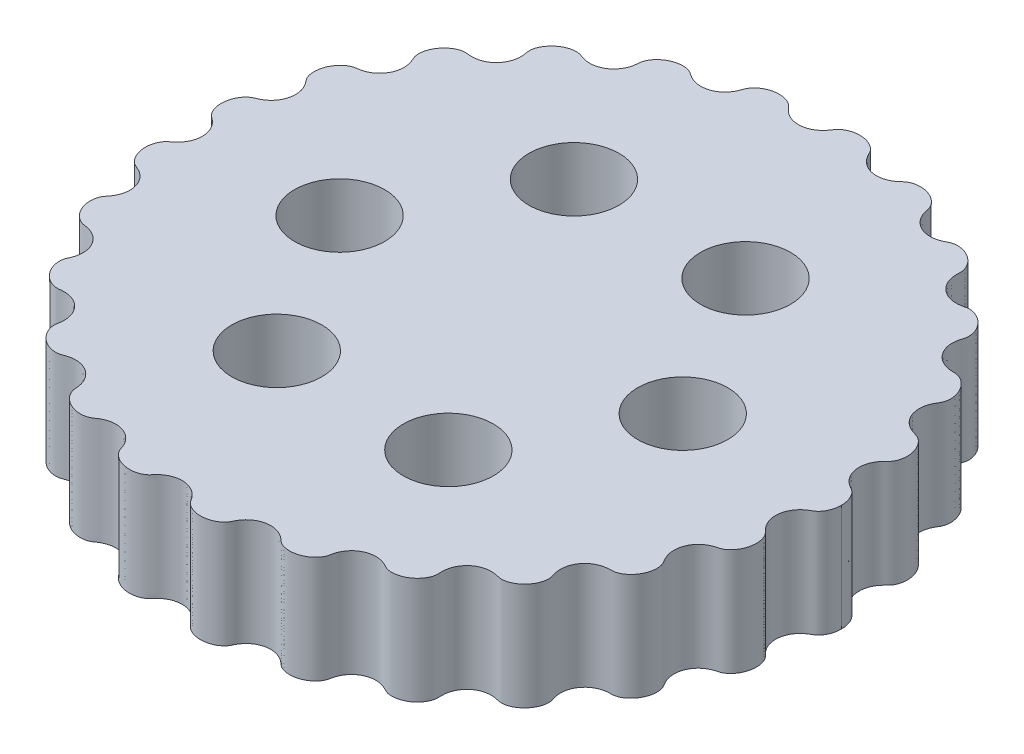
from build123d import *

# Parameters (mm, degrees)
BOSS_EXTRUDE1_DEPTH = 5
SKETCH4_R           = 2.1
CUT_EXTRUDE1_DEPTH  = 23.948222139


with BuildPart() as part:
    # Sketch3 → Boss-Extrude1 (new body)
    with BuildSketch(Plane(origin=(0, 0, 0), x_dir=(1, 0, 0), z_dir=(0, 1, 0))):
        with BuildLine():
            add(Edge.make_bspline(
                [(-15.4, -1.7e-08), (-15.4, -0.0179639), (-15.400999323, -0.054155777), (-15.405496281, -0.123245559), (-15.417452591, -0.205733747), (-15.435300776, -0.284760884), (-15.458936185, -0.36382984), (-15.4955307, -0.460103318), (-15.553831728, -0.577672704), (-15.628963253, -0.690475222), (-15.720523696, -0.795156244), (-15.809877897, -0.878529714), (-15.885972355, -0.939710329), (-15.965266265, -0.996877228), (-16.039390288, -1.060755735), (-16.10181304, -1.136526935), (-16.154322588, -1.219306622), (-16.208602379, -1.329232849), (-16.256294452, -1.46879725), (-16.288096989, -1.638083761), (-16.294503336, -1.881017955), (-16.252297954, -2.119867972), (-16.163760076, -2.344380216), (-16.042398431, -2.523140087), (-15.942454271, -2.628650585), (-15.845311894, -2.703603777), (-15.757199339, -2.750371169), (-15.664408514, -2.786732354), (-15.573413087, -2.826965839), (-15.463621848, -2.885730199), (-15.308968468, -2.990239539), (-15.130503779, -3.165844736), (-14.972147574, -3.434992914), (-14.893985659, -3.773341986), (-14.916927638, -4.080338877), (-14.99517113, -4.310200414), (-15.082412287, -4.468541985), (-15.150259423, -4.567703676), (-15.210025776, -4.642870286), (-15.270573612, -4.717649143), (-15.32017627, -4.800200549), (-15.365416739, -4.910918984), (-15.399338412, -5.049561592), (-15.416852165, -5.262398458), (-15.384340028, -5.5009375), (-15.304055963, -5.731023402), (-15.177986067, -5.941781697), (-15.047854273, -6.095731633), (-14.910789064, -6.208565627), (-14.777136668, -6.28441619), (-14.654566295, -6.325933715), (-14.550559851, -6.34133531), (-14.446683567, -6.35561525), (-14.344145812, -6.378219285), (-14.218558725, -6.416412597), (-14.049117893, -6.490187762), (-13.850381141, -6.623876916), (-13.649361581, -6.848376603), (-13.506075289, -7.152261929), (-13.462998345, -7.45100292), (-13.489971843, -7.692058337), (-13.539204567, -7.862350469), (-13.58028655, -7.968000385), (-13.618269724, -8.050352742), (-13.654435369, -8.133644503), (-13.678283679, -8.221362416), (-13.692937864, -8.335980969), (-13.690655579, -8.476153238), (-13.654303066, -8.685493325), (-13.545223721, -8.951238924), (-13.373056915, -9.18372267), (-13.149188347, -9.366304533), (-12.953264028, -9.463318121), (-12.811586105, -9.506241228), (-12.68673142, -9.522483755), (-12.583488535, -9.516968649), (-12.481158125, -9.503432716), (-12.378198476, -9.49685897), (-12.27492903, -9.498212364), (-12.172138273, -9.508022388), (-12.00848977, -9.538189582), (-11.791017895, -9.615836238), (-11.543764772, -9.778692112), (-11.347433699, -10.024278174), (-11.24020905, -10.268607243), (-11.19432556, -10.4842435), (-11.185347516, -10.63842955), (-11.193136478, -10.770510134), (-11.209146043, -10.879533357), (-11.225593066, -10.966240155), (-11.235972293, -11.053921722), (-11.233096174, -11.14231144), (-11.215768637, -11.253426089), (-11.176715648, -11.384209608), (-11.088557124, -11.571772914), (-10.914554892, -11.800570582), (-10.643928842, -12.015790255), (-10.338393618, -12.131431431), (-10.092328192, -12.151919487), (-9.938831235, -12.124722276), (-9.874147715, -12.104917478), (-9.823296604, -12.086266589), (-9.760021595, -12.062210307), (-9.657742326, -12.026792469), (-9.512708412, -11.991319544), (-9.295428082, -11.971044547), (-9.02334194, -12.005783395), (-8.739745297, -12.120021194), (-8.477485926, -12.330308501), (-8.309271036, -12.575785962), (-8.227745391, -12.796401702), (-8.194847398, -12.964652111), (-8.183073102, -13.072922796), (-8.177409858, -13.159952001), (-8.163855825, -13.268191546), (-8.120743914, -13.396146369), (-8.043211398, -13.535732082), (-7.896275201, -13.715388562), (-7.667817547, -13.89629622), (-7.347778673, -14.038713114), (-7.019984797, -14.07273381), (-6.761854834, -14.026889823), (-6.59853775, -13.94382338), (-6.512636175, -13.880075123), (-6.401772895, -13.805681084), (-6.259871426, -13.730304261), (-6.052431116, -13.656485392), (-5.773826739, -13.622953293), (-5.462558712, -13.668320375), (-5.188838654, -13.799904226), (-4.991154659, -13.966548005), (-4.857833569, -14.133925624), (-4.782594941, -14.263163017), (-4.730894943, -14.37994671), (-4.695923054, -14.480037727), (-4.66890297, -14.56056082), (-4.625076131, -14.657310654), (-4.54939566, -14.764706998), (-4.439982259, -14.875186463), (-4.255657312, -15.006022923), (-3.992826377, -15.120143933), (-3.651468639, -15.175703502), (-3.340640217, -15.129056134), (-3.125824401, -15.033765101), (-3.010951868, -14.946774658), (-2.969759145, -14.909017318), (-2.931738803, -14.868052577), (-2.895415689, -14.825543041), (-2.84986284, -14.772584095), (-2.7734756, -14.691023901), (-2.657607025, -14.589329641), (-2.467715995, -14.468702204), (-2.201270046, -14.374829479), (-1.894275868, -14.351781179), (-1.570472458, -14.423576615), (-1.317305203, -14.563244078), (-1.151543923, -14.714094048), (-1.04813492, -14.841768331), (-0.988592189, -14.928872781), (-0.943008575, -15.000049311), (-0.879486199, -15.084516921), (-0.783319073, -15.171117196), (-0.654507937, -15.252082104), (-0.451621783, -15.335584214), (-0.187231226, -15.385412397), (0.083980968, -15.372590964), (0.344980032, -15.297228196), (0.543453885, -15.192187935), (0.665765143, -15.097631221), (0.754670734, -15.002004552), (0.81122491, -14.912765397), (0.848285287, -14.836852758), (0.894840455, -14.74223026), (0.98113323, -14.596440599), (1.130461793, -14.415291718), (1.371747889, -14.237402863), (1.694146895, -14.124303695), (2.005808041, -14.112082231), (2.279803051, -14.174237519), (2.481366281, -14.271328262), (2.607738457, -14.358112186), (2.692850973, -14.429557513), (2.744274132, -14.47627699), (2.785484759, -14.513602657), (2.83903745, -14.557815956), (2.971848236, -14.642560885), (3.209212351, -14.716336014), (3.537870388, -14.723205652), (3.870973419, -14.623309487), (4.11916488, -14.474113286), (4.287203057, -14.316127467), (4.381819528, -14.188748976), (4.44158696, -14.068624449), (4.46975473, -13.963936363), (4.486205481, -13.878818184), (4.510615899, -13.773375752), (4.562786182, -13.611201438), (4.66864039, -13.402850265), (4.861501994, -13.180790163), (5.140858177, -13.003604886), (5.432389304, -12.920478681), (5.707047345, -12.913935038), (5.924587681, -12.957968109), (6.070502921, -13.011926078), (6.171892994, -13.061226431), (6.234172828, -13.094293466), (6.284238608, -13.120335816), (6.348454821, -13.149382165), (6.450393222, -13.181304954), (6.592860438, -13.199324221), (6.822504709, -13.187513089), (7.108179517, -13.101881376), (7.360700325, -12.94808107), (7.564054883, -12.73925691), (7.686860667, -12.541024919), (7.745859355, -12.391333051), (7.771139719, -12.25794445), (7.769723909, -12.148157851), (7.764489141, -12.060599044), (7.763284167, -11.951024257), (7.773134803, -11.821211353), (7.801859755, -11.67318884), (7.872937972, -11.471739613), (8.004528849, -11.24999796), (8.220498534, -11.035105946), (8.499738314, -10.890461176), (8.747534026, -10.836884184), (8.938296489, -10.832212379), (9.067515609, -10.84372343), (9.169837853, -10.860856784), (9.270401729, -10.885914792), (9.371725278, -10.908894608), (9.499541205, -10.914402306), (9.649899789, -10.893031253), (9.864422416, -10.823594645), (10.115447302, -10.670178671), (10.318488659, -10.460804359), (10.461426998, -10.211874516), (10.524753244, -10.013390778), (10.546392194, -9.877676821), (10.548710352, -9.764592984), (10.539340366, -9.676133963), (10.516898829, -9.59020607), (10.489593571, -9.505763599), (10.460576873, -9.398790161), (10.437116372, -9.267754133), (10.428038926, -9.112623212), (10.448899743, -8.891731524), (10.525306813, -8.64437807), (10.680560241, -8.391693434), (10.908335396, -8.189291613), (11.146089939, -8.066430889), (11.351541147, -8.0111775), (11.509041531, -7.991838751), (11.640826936, -7.989459787), (11.746564255, -7.988165472), (11.874375994, -7.963827156), (12.017764748, -7.905879024), (12.169249379, -7.811411044), (12.319018229, -7.674673684), (12.471981877, -7.480513941), (12.581459023, -7.260882683), (12.644013621, -7.026574368), (12.652861266, -6.812938998), (12.636539545, -6.672849387), (12.606445883, -6.5605133), (12.570431517, -6.476445233), (12.523166311, -6.398236767), (12.47516976, -6.320637062), (12.421523381, -6.219947933), (12.352206784, -6.055608729), (12.297223468, -5.817804774), (12.306144256, -5.511230912), (12.418271093, -5.185791565), (12.599550957, -4.937284708), (12.788421932, -4.782569721), (12.950444572, -4.693121703), (13.068010823, -4.6440806), (13.16467846, -4.61208059), (13.263358977, -4.586967488), (13.360622852, -4.556202811), (13.472064743, -4.497212422), (13.590575025, -4.405386881), (13.741515844, -4.240875834), (13.885567919, -3.984039), (13.960547448, -3.70001255), (13.96247714, -3.409355977), (13.917122724, -3.199364102), (13.864866306, -3.065549508), (13.804762582, -2.961266953), (13.743749695, -2.885984813), (13.673498703, -2.819365216), (13.604760055, -2.751453192), (13.541077577, -2.67863428), (13.482882445, -2.60133554), (13.398435152, -2.468447693), (13.309916002, -2.267780725), (13.257239645, -1.991629219), (13.294765521, -1.652710176), (13.415656685, -1.372496179), (13.564768534, -1.180601513), (13.700945726, -1.058516365), (13.801501699, -0.985660094), (13.885953477, -0.933564852), (13.973240527, -0.886145841), (14.05595319, -0.830914413), (14.145346016, -0.74570159), (14.234104588, -0.627875673), (14.302099652, -0.497915946), (14.350570879, -0.359468477), (14.378415715, -0.242179542), (14.393222635, -0.147287137), (14.398767776, -0.06351789), (14.4, -0.021212327), (14.4, -1.7e-08)],
                knots=[0.062565796, 0.062565796, 0.062565796, 0.062565796, 0.062565796, 0.063859973, 0.06515415, 0.066448326, 0.067742503, 0.06903668, 0.070330857, 0.07291921, 0.075992333, 0.077528894, 0.079065456, 0.080602017, 0.082138578, 0.08367514, 0.085211701, 0.086753761, 0.088295822, 0.091379943, 0.094464064, 0.097548185, 0.103528845, 0.106519174, 0.109509504, 0.111075374, 0.112641243, 0.114207112, 0.115772981, 0.117338851, 0.11890472, 0.122036458, 0.127492162, 0.132947866, 0.138255082, 0.143562297, 0.146585003, 0.148096356, 0.149607709, 0.151119061, 0.152630414, 0.154141767, 0.15565312, 0.158617995, 0.161582869, 0.167512619, 0.170668106, 0.173823593, 0.17697908, 0.180134567, 0.181785014, 0.183435461, 0.185085908, 0.186736355, 0.188386802, 0.190037249, 0.193338142, 0.198333612, 0.203329082, 0.208757311, 0.21418554, 0.217038738, 0.218465337, 0.219891935, 0.221318534, 0.222745133, 0.224171732, 0.225598331, 0.22856804, 0.23153775, 0.237477169, 0.243508984, 0.246524892, 0.2495408, 0.251163787, 0.252786774, 0.254409762, 0.256032749, 0.257655736, 0.259278723, 0.26090171, 0.262524697, 0.268116353, 0.273708009, 0.279232337, 0.2819945, 0.284756664, 0.287531357, 0.288918704, 0.290306051, 0.291693397, 0.293080744, 0.294468091, 0.295855437, 0.298751953, 0.301648468, 0.307441499, 0.313806246, 0.320170993, 0.321874543, 0.322726318, 0.323578093, 0.324429868, 0.325281643, 0.326985192, 0.330392292, 0.333799391, 0.338941908, 0.344084424, 0.349371027, 0.354657629, 0.357399899, 0.358771034, 0.360142168, 0.361513303, 0.362884438, 0.365626708, 0.368571539, 0.37151637, 0.377406032, 0.383827609, 0.390249186, 0.391929851, 0.393610516, 0.39529118, 0.396971845, 0.400333174, 0.403694503, 0.409075747, 0.41445699, 0.419832854, 0.422520785, 0.425208717, 0.427878342, 0.429213155, 0.430547968, 0.431882781, 0.433217593, 0.435887219, 0.438758038, 0.441628857, 0.447370496, 0.453780785, 0.460191075, 0.461070296, 0.461949517, 0.462828738, 0.463707959, 0.46458718, 0.465466401, 0.467224842, 0.470741726, 0.47425861, 0.479541903, 0.484825197, 0.489835983, 0.494846769, 0.497503724, 0.498832202, 0.500160679, 0.501489157, 0.502817634, 0.505474589, 0.508247059, 0.511019529, 0.516564468, 0.52227034, 0.525123276, 0.527976212, 0.530631288, 0.531958826, 0.533286364, 0.534613902, 0.53594144, 0.538596516, 0.543936045, 0.549275574, 0.554531257, 0.559786941, 0.563284399, 0.566781857, 0.568530587, 0.569404951, 0.570279316, 0.57115368, 0.572028045, 0.573776774, 0.580152949, 0.586529123, 0.592383377, 0.595310504, 0.598237631, 0.600962992, 0.602325673, 0.603688354, 0.605051034, 0.606413715, 0.609139076, 0.614392618, 0.619646159, 0.624660447, 0.629674735, 0.633223523, 0.636772312, 0.638546707, 0.639433904, 0.640321101, 0.641208298, 0.642095495, 0.64386989, 0.647025799, 0.650181709, 0.656493529, 0.662419511, 0.665382503, 0.668345494, 0.671104535, 0.672484055, 0.673863575, 0.675243096, 0.676622616, 0.679381657, 0.682041398, 0.68470114, 0.690020622, 0.695473381, 0.700926139, 0.704188253, 0.70581931, 0.707450368, 0.709081425, 0.710712482, 0.712343539, 0.713974596, 0.717095441, 0.720216286, 0.726457975, 0.732286917, 0.735201388, 0.738115858, 0.739511278, 0.740906697, 0.742302116, 0.743697535, 0.745092954, 0.746488373, 0.749279211, 0.752059022, 0.754838832, 0.760398454, 0.765423781, 0.770449108, 0.773768675, 0.777088241, 0.778748025, 0.780407808, 0.782067591, 0.783727374, 0.786901153, 0.790074931, 0.793248709, 0.796422487, 0.802397424, 0.805384893, 0.808372361, 0.809807963, 0.811243566, 0.812679168, 0.81411477, 0.815550372, 0.816985974, 0.819857178, 0.825317904, 0.830778629, 0.835989797, 0.841200965, 0.844404173, 0.846005778, 0.847607382, 0.849208986, 0.85081059, 0.852412194, 0.854013798, 0.857107086, 0.860200373, 0.866386948, 0.872352981, 0.875335998, 0.878319014, 0.879839881, 0.881360748, 0.882881615, 0.884402482, 0.885923349, 0.887444216, 0.888965083, 0.890485949, 0.895823145, 0.90116034, 0.906397405, 0.911634469, 0.914757263, 0.91631866, 0.917880057, 0.919441454, 0.921002851, 0.922564248, 0.924125645, 0.927182053, 0.930238461, 0.931766665, 0.933294869, 0.934823073, 0.936351277, 0.936351277, 0.936351277, 0.936351277, 0.936351277], degree=4))
            add(Edge.make_bspline(
                [(-15.4, -1.7e-08), (-15.4, 0.017963998), (-15.400999323, 0.054155875), (-15.405496281, 0.123245657), (-15.417452591, 0.205733845), (-15.435300776, 0.284760982), (-15.458936185, 0.363829937), (-15.4955307, 0.460103416), (-15.553831728, 0.577672801), (-15.628963253, 0.69047532), (-15.720523696, 0.795156342), (-15.809877897, 0.878529812), (-15.885972355, 0.939710427), (-15.965266265, 0.996877326), (-16.039390288, 1.060755833), (-16.10181304, 1.136527033), (-16.154322588, 1.21930672), (-16.208602379, 1.329232947), (-16.256294452, 1.468797348), (-16.288096989, 1.638083858), (-16.294503336, 1.881018053), (-16.252297954, 2.11986807), (-16.163760076, 2.344380314), (-16.042398431, 2.523140184), (-15.942454271, 2.628650683), (-15.845311894, 2.703603875), (-15.757199339, 2.750371267), (-15.664408514, 2.786732452), (-15.573413087, 2.826965937), (-15.463621848, 2.885730297), (-15.308968468, 2.990239637), (-15.130503779, 3.165844833), (-14.972147574, 3.434993012), (-14.893985659, 3.773342084), (-14.916927638, 4.080338975), (-14.99517113, 4.310200511), (-15.082412287, 4.468542083), (-15.150259423, 4.567703774), (-15.210025776, 4.642870383), (-15.270573612, 4.717649241), (-15.32017627, 4.800200647), (-15.365416739, 4.910919082), (-15.399338412, 5.049561689), (-15.416852165, 5.262398556), (-15.384340028, 5.500937598), (-15.304055963, 5.7310235), (-15.177986067, 5.941781795), (-15.047854273, 6.095731731), (-14.910789064, 6.208565725), (-14.777136668, 6.284416288), (-14.654566295, 6.325933813), (-14.550559851, 6.341335407), (-14.446683567, 6.355615347), (-14.344145812, 6.378219383), (-14.218558725, 6.416412695), (-14.049117893, 6.49018786), (-13.850381141, 6.623877014), (-13.649361581, 6.8483767), (-13.506075288, 7.152262026), (-13.462998345, 7.451003018), (-13.489971843, 7.692058434), (-13.539204567, 7.862350567), (-13.58028655, 7.968000482), (-13.618269724, 8.050352839), (-13.654435369, 8.133644601), (-13.678283679, 8.221362514), (-13.692937864, 8.335981067), (-13.690655579, 8.476153336), (-13.654303066, 8.685493422), (-13.545223721, 8.951239022), (-13.373056915, 9.183722768), (-13.149188347, 9.36630463), (-12.953264028, 9.463318219), (-12.811586105, 9.506241326), (-12.68673142, 9.522483852), (-12.583488535, 9.516968747), (-12.481158125, 9.503432814), (-12.378198476, 9.496859067), (-12.27492903, 9.498212462), (-12.172138273, 9.508022486), (-12.00848977, 9.53818968), (-11.791017895, 9.615836336), (-11.543764772, 9.77869221), (-11.347433699, 10.024278272), (-11.24020905, 10.268607341), (-11.19432556, 10.484243598), (-11.185347516, 10.638429648), (-11.193136478, 10.770510232), (-11.209146043, 10.879533455), (-11.225593066, 10.966240253), (-11.235972293, 11.05392182), (-11.233096174, 11.142311538), (-11.215768637, 11.253426187), (-11.176715648, 11.384209706), (-11.088557124, 11.571773012), (-10.914554892, 11.80057068), (-10.643928842, 12.015790353), (-10.338393618, 12.131431529), (-10.092328192, 12.151919585), (-9.938831235, 12.124722374), (-9.874147715, 12.104917576), (-9.823296604, 12.086266686), (-9.760021595, 12.062210404), (-9.657742326, 12.026792566), (-9.512708412, 11.991319642), (-9.295428082, 11.971044645), (-9.02334194, 12.005783493), (-8.739745297, 12.120021292), (-8.477485926, 12.330308598), (-8.309271036, 12.575786059), (-8.227745391, 12.7964018), (-8.194847398, 12.964652209), (-8.183073102, 13.072922894), (-8.177409857, 13.159952099), (-8.163855825, 13.268191644), (-8.120743913, 13.396146467), (-8.043211398, 13.53573218), (-7.8962752, 13.71538866), (-7.667817547, 13.896296318), (-7.347778673, 14.038713212), (-7.019984797, 14.072733908), (-6.761854834, 14.026889921), (-6.59853775, 13.943823477), (-6.512636175, 13.880075221), (-6.401772895, 13.805681182), (-6.259871426, 13.730304358), (-6.052431116, 13.65648549), (-5.773826739, 13.62295339), (-5.462558712, 13.668320473), (-5.188838654, 13.799904324), (-4.991154659, 13.966548103), (-4.857833569, 14.133925722), (-4.782594941, 14.263163115), (-4.730894943, 14.379946808), (-4.695923054, 14.480037824), (-4.66890297, 14.560560918), (-4.625076131, 14.657310752), (-4.54939566, 14.764707096), (-4.439982259, 14.875186561), (-4.255657312, 15.006023021), (-3.992826377, 15.120144031), (-3.651468639, 15.1757036), (-3.340640217, 15.129056232), (-3.125824401, 15.033765199), (-3.010951868, 14.946774755), (-2.969759145, 14.909017416), (-2.931738803, 14.868052675), (-2.895415689, 14.825543139), (-2.84986284, 14.772584193), (-2.7734756, 14.691023999), (-2.657607025, 14.589329739), (-2.467715995, 14.468702301), (-2.201270046, 14.374829577), (-1.894275868, 14.351781276), (-1.570472458, 14.423576713), (-1.317305203, 14.563244176), (-1.151543923, 14.714094145), (-1.04813492, 14.841768429), (-0.988592189, 14.928872879), (-0.943008575, 15.000049408), (-0.879486199, 15.084517019), (-0.783319073, 15.171117294), (-0.654507937, 15.252082202), (-0.451621783, 15.335584312), (-0.187231226, 15.385412494), (0.083980968, 15.372591062), (0.344980032, 15.297228294), (0.543453885, 15.192188032), (0.665765143, 15.097631319), (0.754670734, 15.00200465), (0.81122491, 14.912765494), (0.848285287, 14.836852855), (0.894840455, 14.742230357), (0.98113323, 14.596440697), (1.130461793, 14.415291815), (1.371747889, 14.237402961), (1.694146896, 14.124303793), (2.005808041, 14.112082329), (2.279803051, 14.174237617), (2.481366281, 14.27132836), (2.607738457, 14.358112283), (2.692850973, 14.429557611), (2.744274132, 14.476277088), (2.785484759, 14.513602755), (2.83903745, 14.557816053), (2.971848236, 14.642560983), (3.209212351, 14.716336112), (3.537870388, 14.723205749), (3.870973419, 14.623309585), (4.11916488, 14.474113384), (4.287203058, 14.316127565), (4.381819528, 14.188749074), (4.44158696, 14.068624547), (4.46975473, 13.963936461), (4.486205481, 13.878818282), (4.510615899, 13.77337585), (4.562786182, 13.611201536), (4.66864039, 13.402850363), (4.861501994, 13.180790261), (5.140858177, 13.003604984), (5.432389304, 12.920478779), (5.707047345, 12.913935136), (5.924587681, 12.957968207), (6.070502921, 13.011926176), (6.171892994, 13.061226529), (6.234172828, 13.094293563), (6.284238608, 13.120335914), (6.348454821, 13.149382263), (6.450393222, 13.181305052), (6.592860438, 13.199324319), (6.822504709, 13.187513187), (7.108179517, 13.101881474), (7.360700325, 12.948081168), (7.564054883, 12.739257008), (7.686860667, 12.541025017), (7.745859355, 12.391333149), (7.771139719, 12.257944548), (7.76972391, 12.148157949), (7.764489142, 12.060599142), (7.763284167, 11.951024354), (7.773134803, 11.821211451), (7.801859755, 11.673188937), (7.872937972, 11.471739711), (8.004528849, 11.249998058), (8.220498534, 11.035106043), (8.499738314, 10.890461274), (8.747534026, 10.836884282), (8.938296489, 10.832212477), (9.067515609, 10.843723528), (9.169837853, 10.860856882), (9.27040173, 10.885914889), (9.371725278, 10.908894705), (9.499541205, 10.914402403), (9.649899789, 10.893031351), (9.864422416, 10.823594743), (10.115447302, 10.670178769), (10.318488659, 10.460804456), (10.461426998, 10.211874613), (10.524753244, 10.013390876), (10.546392194, 9.877676918), (10.548710352, 9.764593082), (10.539340366, 9.676134061), (10.516898829, 9.590206168), (10.489593571, 9.505763697), (10.460576873, 9.398790259), (10.437116372, 9.267754231), (10.428038926, 9.112623309), (10.448899743, 8.891731622), (10.525306813, 8.644378167), (10.680560241, 8.391693532), (10.908335396, 8.189291711), (11.146089939, 8.066430986), (11.351541147, 8.011177598), (11.509041531, 7.991838848), (11.640826936, 7.989459884), (11.746564255, 7.98816557), (11.874375994, 7.963827254), (12.017764748, 7.905879122), (12.169249379, 7.811411142), (12.319018229, 7.674673782), (12.471981877, 7.480514038), (12.581459023, 7.26088278), (12.644013621, 7.026574465), (12.652861266, 6.812939095), (12.636539545, 6.672849485), (12.606445883, 6.560513397), (12.570431517, 6.476445331), (12.523166311, 6.398236864), (12.47516976, 6.32063716), (12.421523381, 6.219948031), (12.352206784, 6.055608827), (12.297223468, 5.817804871), (12.306144256, 5.51123101), (12.418271093, 5.185791663), (12.599550957, 4.937284806), (12.788421932, 4.782569819), (12.950444572, 4.6931218), (13.068010823, 4.644080697), (13.16467846, 4.612080687), (13.263358978, 4.586967586), (13.360622852, 4.556202909), (13.472064743, 4.49721252), (13.590575025, 4.405386979), (13.741515844, 4.240875931), (13.885567919, 3.984039098), (13.960547448, 3.700012648), (13.96247714, 3.409356074), (13.917122724, 3.199364199), (13.864866306, 3.065549606), (13.804762582, 2.96126705), (13.743749695, 2.88598491), (13.673498703, 2.819365314), (13.604760055, 2.75145329), (13.541077577, 2.678634378), (13.482882445, 2.601335638), (13.398435152, 2.468447791), (13.309916002, 2.267780823), (13.257239645, 1.991629317), (13.294765521, 1.652710273), (13.415656685, 1.372496277), (13.564768534, 1.180601611), (13.700945726, 1.058516462), (13.801501699, 0.985660192), (13.885953477, 0.933564949), (13.973240527, 0.886145938), (14.05595319, 0.830914511), (14.145346016, 0.745701687), (14.234104588, 0.62787577), (14.302099652, 0.497916044), (14.350570879, 0.359468575), (14.378415715, 0.242179639), (14.393222635, 0.147287235), (14.398767776, 0.063517988), (14.4, 0.021212425), (14.4, -1.7e-08)],
                knots=[0.062565796, 0.062565796, 0.062565796, 0.062565796, 0.062565796, 0.063859973, 0.06515415, 0.066448326, 0.067742503, 0.06903668, 0.070330857, 0.07291921, 0.075992333, 0.077528894, 0.079065456, 0.080602017, 0.082138578, 0.08367514, 0.085211701, 0.086753761, 0.088295822, 0.091379943, 0.094464064, 0.097548185, 0.103528845, 0.106519174, 0.109509504, 0.111075374, 0.112641243, 0.114207112, 0.115772981, 0.117338851, 0.11890472, 0.122036458, 0.127492162, 0.132947866, 0.138255082, 0.143562297, 0.146585003, 0.148096356, 0.149607709, 0.151119061, 0.152630414, 0.154141767, 0.15565312, 0.158617995, 0.161582869, 0.167512619, 0.170668106, 0.173823593, 0.17697908, 0.180134567, 0.181785014, 0.183435461, 0.185085908, 0.186736355, 0.188386802, 0.190037249, 0.193338142, 0.198333612, 0.203329082, 0.208757311, 0.21418554, 0.217038738, 0.218465337, 0.219891935, 0.221318534, 0.222745133, 0.224171732, 0.225598331, 0.22856804, 0.23153775, 0.237477169, 0.243508984, 0.246524892, 0.2495408, 0.251163787, 0.252786774, 0.254409762, 0.256032749, 0.257655736, 0.259278723, 0.26090171, 0.262524697, 0.268116353, 0.273708009, 0.279232337, 0.2819945, 0.284756664, 0.287531357, 0.288918704, 0.290306051, 0.291693397, 0.293080744, 0.294468091, 0.295855437, 0.298751953, 0.301648468, 0.307441499, 0.313806246, 0.320170993, 0.321874543, 0.322726318, 0.323578093, 0.324429868, 0.325281643, 0.326985192, 0.330392292, 0.333799391, 0.338941908, 0.344084424, 0.349371027, 0.354657629, 0.357399899, 0.358771034, 0.360142168, 0.361513303, 0.362884438, 0.365626708, 0.368571539, 0.37151637, 0.377406032, 0.383827609, 0.390249186, 0.391929851, 0.393610516, 0.39529118, 0.396971845, 0.400333174, 0.403694503, 0.409075747, 0.41445699, 0.419832854, 0.422520785, 0.425208717, 0.427878342, 0.429213155, 0.430547968, 0.431882781, 0.433217593, 0.435887219, 0.438758038, 0.441628857, 0.447370496, 0.453780785, 0.460191075, 0.461070296, 0.461949517, 0.462828738, 0.463707959, 0.46458718, 0.465466401, 0.467224842, 0.470741726, 0.47425861, 0.479541903, 0.484825197, 0.489835983, 0.494846769, 0.497503724, 0.498832202, 0.500160679, 0.501489157, 0.502817634, 0.505474589, 0.508247059, 0.511019529, 0.516564468, 0.52227034, 0.525123276, 0.527976212, 0.530631288, 0.531958826, 0.533286364, 0.534613902, 0.53594144, 0.538596516, 0.543936045, 0.549275574, 0.554531257, 0.559786941, 0.563284399, 0.566781857, 0.568530587, 0.569404951, 0.570279316, 0.57115368, 0.572028045, 0.573776774, 0.580152949, 0.586529123, 0.592383377, 0.595310504, 0.598237631, 0.600962992, 0.602325673, 0.603688354, 0.605051034, 0.606413715, 0.609139076, 0.614392618, 0.619646159, 0.624660447, 0.629674735, 0.633223523, 0.636772312, 0.638546707, 0.639433904, 0.640321101, 0.641208298, 0.642095495, 0.64386989, 0.647025799, 0.650181709, 0.656493529, 0.662419511, 0.665382503, 0.668345494, 0.671104535, 0.672484055, 0.673863575, 0.675243096, 0.676622616, 0.679381657, 0.682041398, 0.68470114, 0.690020622, 0.695473381, 0.700926139, 0.704188253, 0.70581931, 0.707450368, 0.709081425, 0.710712482, 0.712343539, 0.713974596, 0.717095441, 0.720216286, 0.726457975, 0.732286917, 0.735201388, 0.738115858, 0.739511278, 0.740906697, 0.742302116, 0.743697535, 0.745092954, 0.746488373, 0.749279211, 0.752059022, 0.754838832, 0.760398454, 0.765423781, 0.770449108, 0.773768675, 0.777088241, 0.778748025, 0.780407808, 0.782067591, 0.783727374, 0.786901153, 0.790074931, 0.793248709, 0.796422487, 0.802397424, 0.805384893, 0.808372361, 0.809807963, 0.811243566, 0.812679168, 0.81411477, 0.815550372, 0.816985974, 0.819857178, 0.825317904, 0.830778629, 0.835989797, 0.841200965, 0.844404173, 0.846005778, 0.847607382, 0.849208986, 0.85081059, 0.852412194, 0.854013798, 0.857107086, 0.860200373, 0.866386948, 0.872352981, 0.875335998, 0.878319014, 0.879839881, 0.881360748, 0.882881615, 0.884402482, 0.885923349, 0.887444216, 0.888965083, 0.890485949, 0.895823145, 0.90116034, 0.906397405, 0.911634469, 0.914757263, 0.91631866, 0.917880057, 0.919441454, 0.921002851, 0.922564248, 0.924125645, 0.927182053, 0.930238461, 0.931766665, 0.933294869, 0.934823073, 0.936351277, 0.936351277, 0.936351277, 0.936351277, 0.936351277], degree=4))
        make_face()
    extrude(amount=-BOSS_EXTRUDE1_DEPTH)

    # Sketch4 → Cut-Extrude1 (cut, through all)
    with BuildSketch(Plane(origin=(0, 0, 0), x_dir=(1, 0, 0), z_dir=(0, 1, 0))):
        with Locations(Location((3, -6.928203117, 0), (0, 0, 90))):
            Circle(SKETCH4_R)
        with Locations(Location((-5, -6.928203117, 0), (0, 0, 90))):
            Circle(SKETCH4_R)
        with Locations(Location((-9, 1.13e-07, 0), (0, 0, 90))):
            Circle(SKETCH4_R)
        with Locations(Location((-5, 6.928203343, 0), (0, 0, 90))):
            Circle(SKETCH4_R)
        with Locations(Location((3, 6.928203343, 0), (0, 0, 90))):
            Circle(SKETCH4_R)
        with Locations(Location((7, 1.13e-07, 0), (0, 0, 90))):
            Circle(SKETCH4_R)
    extrude(amount=-CUT_EXTRUDE1_DEPTH, mode=Mode.SUBTRACT)


solid = part.part
